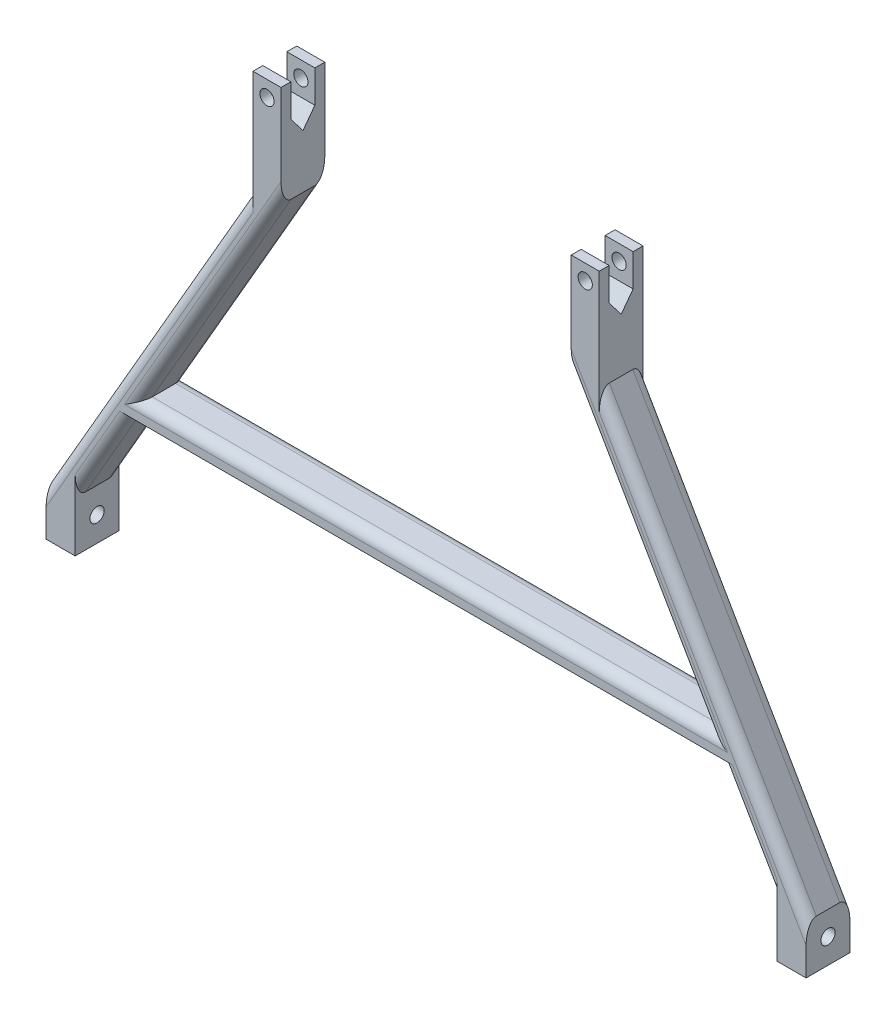
from build123d import *

# Parameters (mm, degrees)
BOSS_EXTRUDE1_DEPTH = 10.922
CUT_EXTRUDE1_DEPTH  = 114.427
SKETCH4_R           = 1.778
CUT_EXTRUDE2_DEPTH  = 114.427
SKETCH5_R           = 1.778
CUT_EXTRUDE3_DEPTH  = 114.427
SKETCH6_R           = 1.778
CUT_EXTRUDE4_DEPTH  = 251.079
FILLET1_R           = 2.54
FILLET2_R           = 2.54
FILLET3_R           = 2.54
FILLET4_R           = 2.54
FILLET5_R           = 2.54
FILLET6_R           = 2.54


with BuildPart() as part:
    # Sketch1 → Boss-Extrude1 (new body)
    with BuildSketch(Plane.XY):
        Polygon((0, -25.411879188), (0, 0), (-6.985, 0), (-6.985, -25.411879188), (27.675318213, -85.445311339), (-114.035318213, -85.445311339), (-79.375, -25.411879188), (-79.375, 0), (-86.36, 0), (-86.36, -25.411879188), (-137.955366837, -114.777675985), (-137.955366837, -126.876050876), (-130.713866793, -126.876050876), (-130.713866793, -114.333404876), (-116.677285334, -90.021332625), (30.317285334, -90.021332625), (44.353866793, -114.333404876), (44.353866793, -126.876050876), (51.595366837, -126.876050876), (51.595366837, -114.777675985), align=None)
    extrude(amount=BOSS_EXTRUDE1_DEPTH)

    # Sketch3 → Cut-Extrude1 (cut)
    with BuildSketch(Plane(origin=(0, 0, 0), x_dir=(0, 0, -1), z_dir=(1, 0, 0))):
        Polygon((-2.471808629, 0), (-2.492726697, 0), (-8.450191371, 0), (-8.450191371, -8.061399091), (-5.461, -12.079224104), (-2.471808629, -8.061399091), align=None)
    extrude(amount=-CUT_EXTRUDE1_DEPTH, mode=Mode.SUBTRACT)

    # Sketch4 → Cut-Extrude2 (cut)
    with BuildSketch(Plane.XY.offset(10.922)):
        with Locations((-3.4925, -3.83202166)):
            Circle(SKETCH4_R)
    extrude(amount=-CUT_EXTRUDE2_DEPTH, mode=Mode.SUBTRACT)

    # Sketch5 → Cut-Extrude3 (cut)
    with BuildSketch(Plane.XY.offset(10.922)):
        with Locations((-82.8675, -3.918997874)):
            Circle(SKETCH5_R)
    extrude(amount=-CUT_EXTRUDE3_DEPTH, mode=Mode.SUBTRACT)

    # Sketch6 → Cut-Extrude4 (cut)
    with BuildSketch(Plane(origin=(51.595366837, 0, 0), x_dir=(0, 0, -1), z_dir=(1, 0, 0))):
        with Locations((-5.461, -120.687777383)):
            Circle(SKETCH6_R)
    extrude(amount=-CUT_EXTRUDE4_DEPTH, mode=Mode.SUBTRACT)

    # Fillet1
    fillet1_edges = [part.edges().sort_by_distance(p)[0] for p in [
        (37.335576064, -102.177368751, 10.922),
        (25.797683419, -70.094777586, 10.922),
        (10.345159107, -55.428595263, 10.922),
    ]]
    fillet(fillet1_edges, radius=FILLET1_R)

    # Fillet2
    fillet2_edges = [part.edges().sort_by_distance(p)[0] for p in [
        (10.345159107, -55.428595263, 0),
        (25.797683419, -70.094777586, 0),
        (37.335576064, -102.177368751, 0),
    ]]
    fillet(fillet2_edges, radius=FILLET2_R)

    # Fillet3
    fillet3_edges = [part.edges().sort_by_distance(p)[0] for p in [
        (-41.713530316, -85.445311339, 10.922),
    ]]
    fillet(fillet3_edges, radius=FILLET3_R)

    # Fillet4
    fillet4_edges = [part.edges().sort_by_distance(p)[0] for p in [
        (-41.713530316, -85.445311339, 0),
    ]]
    fillet(fillet4_edges, radius=FILLET4_R)

    # Fillet5
    fillet5_edges = [part.edges().sort_by_distance(p)[0] for p in [
        (-97.438393948, -56.698595263, 0),
        (-123.695576064, -102.177368751, 10.922),
        (-112.157683419, -70.094777586, 10.922),
        (-97.438393948, -56.698595263, 10.922),
    ]]
    fillet(fillet5_edges, radius=FILLET5_R)

    # Fillet6
    fillet6_edges = [part.edges().sort_by_distance(p)[0] for p in [
        (-112.157683419, -70.094777586, 0),
        (-123.695576064, -102.177368751, 0),
    ]]
    fillet(fillet6_edges, radius=FILLET6_R)


solid = part.part
